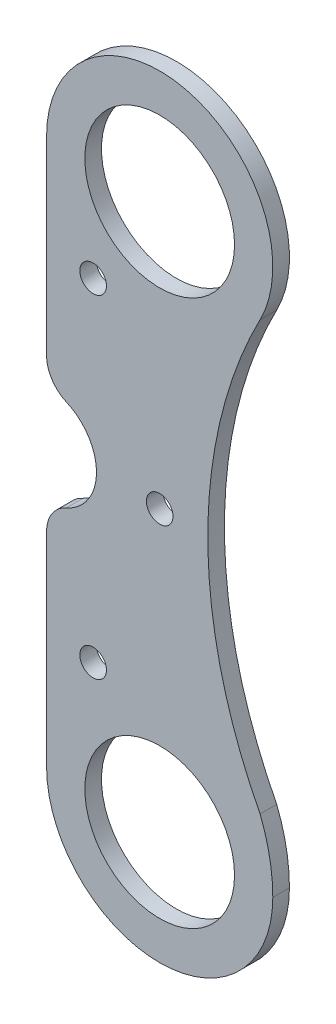
from build123d import *

# Parameters (mm, degrees)
SKETCH1_R           = 14.2875
SKETCH1_R_2         = 2.54
BOSS_EXTRUDE1_DEPTH = 3.175
CUT_EXTRUDE1_DEPTH  = 162.674043733
FILLET3_R           = 6.35
SKETCH3_R           = 2.54
BOSS_EXTRUDE3_DEPTH = 3.175
SKETCH6_R           = 2.54
BOSS_EXTRUDE4_DEPTH = 3.175
FILLET2_R           = 6.35
CUT_EXTRUDE2_DEPTH  = 169.237022961
CUT_EXTRUDE3_DEPTH  = 169.237022961
CUT_EXTRUDE4_DEPTH  = 168.265702461
BOSS_EXTRUDE7_DEPTH = 3.175
SKETCH14_R          = 14.2875
BOSS_EXTRUDE8_DEPTH = 3.175
SKETCH15_R          = 14.2875
CUT_EXTRUDE5_DEPTH  = 128.70732581
CUT_EXTRUDE6_DEPTH  = 128.70732581
SKETCH17_R          = 2.54
CUT_EXTRUDE7_DEPTH  = 128.70732581


with BuildPart() as part:
    # Sketch1 → Boss-Extrude1 (new body)
    with BuildSketch(Plane.XY):
        with BuildLine():
            Line((-8.89, 25.4), (8.89, 25.4))
            ThreePointArc((8.89, 25.4), (17.870256121, 21.680256121), (21.59, 12.7))
            Line((21.59, 12.7), (21.59, -117.775079775))
            ThreePointArc((21.59, -117.775079775), (21.127743647, -120.388718212), (19.797058824, -122.685251408))
            Line((19.797058824, -122.685251408), (-7.952696208, -155.616779465))
            ThreePointArc((-7.952696208, -155.616779465), (-12.268297602, -157.851943494), (-16.900388255, -156.380852124))
            Line((-16.900388255, -156.380852124), (-32.439211784, -143.287061102))
            ThreePointArc((-32.439211784, -143.287061102), (-34.674375812, -138.971459708), (-33.203284443, -134.339369055))
            Line((-33.203284443, -134.339369055), (-23.382941176, -122.685251408))
            ThreePointArc((-23.382941176, -122.685251408), (-22.052256353, -120.388718212), (-21.59, -117.775079775))
            Line((-21.59, -117.775079775), (-21.59, 12.7))
            ThreePointArc((-21.59, 12.7), (-17.870256121, 21.680256121), (-8.89, 25.4))
        make_face()
        Circle(SKETCH1_R, mode=Mode.SUBTRACT)
        with Locations((0, -101.6)):
            Circle(SKETCH1_R, mode=Mode.SUBTRACT)
        with Locations((-18.532085478, -142.550133084)):
            Circle(SKETCH1_R_2, mode=Mode.SUBTRACT)
        with Locations((0, -50.8)):
            Circle(SKETCH1_R_2, mode=Mode.SUBTRACT)
    extrude(amount=BOSS_EXTRUDE1_DEPTH)

    # Sketch2 → Cut-Extrude1 (cut, through all)
    with BuildSketch(Plane.XY):
        with BuildLine():
            ThreePointArc((19.159083004, -91.647229609), (9.182340769, -50.8), (19.159083004, -9.952770391))
            ThreePointArc((19.159083004, -9.952770391), (20.973467787, -5.122670102), (21.59, 0))
            Line((21.59, 0), (27.94, 0))
            Line((27.94, 0), (27.94, -121.656687185))
            Line((27.94, -121.656687185), (-7.620284479, -163.8572221))
            Line((-7.620284479, -163.8572221), (-17.501317584, -155.874478972))
            Line((-17.501317584, -155.874478972), (16.51, -115.512152961))
            ThreePointArc((16.51, -115.512152961), (20.280273667, -109.005308906), (21.59, -101.6))
            ThreePointArc((21.59, -101.6), (20.973467787, -96.477329898), (19.159083004, -91.647229609))
        make_face()
        with BuildLine():
            Line((-21.59, -41.275), (-21.59, -60.325))
            ThreePointArc((-21.59, -60.325), (-12.065, -50.8), (-21.59, -41.275))
        make_face()
    extrude(amount=CUT_EXTRUDE1_DEPTH, mode=Mode.SUBTRACT)


with BuildPart() as cut_extrude1_piece_1:
    # of the separate pieces the step leaves, piece 1, a body of its own (cut_extrude1_pieces)
    add(part.part.solids().sort_by_distance((-8.89, 25.4, 0))[0])

    # Fillet3
    fillet3_edges = [cut_extrude1_piece_1.edges().sort_by_distance(p)[0] for p in [
        (-21.59, -41.275, 1.5875),
        (-21.59, -60.325, 1.5875),
    ]]
    fillet(fillet3_edges, radius=FILLET3_R)

    # Sketch3 → Boss-Extrude3 (add)
    with BuildSketch(Plane.XY.offset(3.175)):
        with BuildLine():
            Line((-27.351416194, -127.394768527), (-36.025496499, -137.688579))
            ThreePointArc((-36.025496499, -137.688579), (-37.217489152, -141.441859142), (-35.4063854, -144.93869507))
            Line((-35.4063854, -144.93869507), (-24.403104784, -154.210610454))
            ThreePointArc((-24.403104784, -154.210610454), (-19.771014132, -155.681701823), (-15.455412737, -153.446537795))
            Line((-15.455412737, -153.446537795), (-7.557639641, -144.073996091))
            Line((-7.557639641, -144.073996091), (-27.351416194, -127.394768527))
        make_face()
        with Locations((-18.532085478, -142.550133084)):
            Circle(SKETCH3_R, mode=Mode.SUBTRACT)
    extrude(amount=-BOSS_EXTRUDE3_DEPTH)

    # Sketch6 → Boss-Extrude4 (add)
    with BuildSketch(Plane.XY.offset(3.175)):
        Polygon((-35.4063854, -144.93869507), (-63.620410749, -121.164144113), (-51.344981666, -106.596497054), (-27.065569901, -127.055545526), align=None)
        with Locations((-52.626813855, -117.972130278)):
            Circle(SKETCH6_R, mode=Mode.SUBTRACT)
    extrude(amount=-BOSS_EXTRUDE4_DEPTH)

    # Fillet2
    fillet2_edges = [cut_extrude1_piece_1.edges().sort_by_distance(p)[0] for p in [
        (-63.620410749, -121.164144113, 1.5875),
        (-51.344981666, -106.596497054, 1.5875),
        (-27.065569901, -127.055545526, 1.5875),
    ]]
    fillet(fillet2_edges, radius=FILLET2_R)

    # Sketch7 → Cut-Extrude2 (cut, through all)
    with BuildSketch(Plane.XY.offset(3.175)):
        with BuildLine():
            Line((-21.59, 0), (-21.59, 31.75))
            Line((-21.59, 31.75), (21.59, 31.75))
            Line((21.59, 31.75), (21.59, 0))
            ThreePointArc((21.59, 0), (0, 21.59), (-21.59, 0))
        make_face()
    extrude(amount=-CUT_EXTRUDE2_DEPTH, mode=Mode.SUBTRACT)


with BuildPart() as cut_extrude1_piece_2:
    # of the separate pieces the step leaves, piece 2, a body of its own (cut_extrude1_pieces)
    add(part.part.solids().sort_by_distance((-16.900388255, -156.380852124, 0))[0])


with BuildPart() as cut_extrude3_tool:
    # Sketch10 → Cut-Extrude3 (new, through all)
    with BuildSketch(Plane.XY.offset(3.175)):
        with BuildLine():
            Line((-18.151882461, -155.32628042), (-17.361482582, -157.512020269))
            Line((-17.361482582, -157.512020269), (-14.375706423, -156.432313955))
            Line((-14.375706423, -156.432313955), (-15.455412737, -153.446537795))
            ThreePointArc((-15.455412737, -153.446537795), (-16.679911193, -154.563907595), (-18.151882461, -155.32628042))
        make_face()
    extrude(amount=-CUT_EXTRUDE3_DEPTH)


with BuildPart() as cut_extrude1_piece_1_1:
    add(cut_extrude1_piece_1.part)

    # Cut-Extrude3: cut by cut_extrude3_tool
    add(cut_extrude3_tool.part, mode=Mode.SUBTRACT)

    # Sketch12 → Cut-Extrude4 (cut, through all)
    with BuildSketch(Plane.XY.offset(3.175)):
        with BuildLine():
            Line((-21.59, -101.6), (-72.39, -101.6))
            Line((-72.39, -101.6), (-72.39, -165.1))
            Line((-72.39, -165.1), (16.51, -165.1))
            Line((16.51, -165.1), (16.51, -115.512152961))
            ThreePointArc((16.51, -115.512152961), (-7.405308906, -121.880273667), (-21.59, -101.6))
        make_face()
    extrude(amount=-CUT_EXTRUDE4_DEPTH, mode=Mode.SUBTRACT)

    # Sketch13 → Boss-Extrude7 (add, through all)
    with BuildSketch(Plane.XY.offset(3.175)):
        with BuildLine():
            Line((-21.59, -101.6), (-21.59, -104.23906))
            ThreePointArc((-21.59, -104.23906), (0, -125.82906), (21.59, -104.23906))
            Line((21.59, -104.23906), (21.59, -101.6))
            Line((21.59, -101.6), (6.662926134, -118.366401535))
            Line((6.662926134, -118.366401535), (-7.350026675, -118.366401535))
            Line((-7.350026675, -118.366401535), (-21.59, -101.6))
        make_face()
    extrude(amount=-BOSS_EXTRUDE7_DEPTH)

    # Sketch14 → Boss-Extrude8 (add, through all)
    with BuildSketch(Plane.XY.offset(3.175)):
        with Locations((0, -101.6)):
            Circle(SKETCH14_R)
    extrude(amount=-BOSS_EXTRUDE8_DEPTH)

    # Sketch15 → Cut-Extrude5 (cut, through all)
    with BuildSketch(Plane.XY.offset(3.175)):
        with Locations((0, -104.23906)):
            Circle(SKETCH15_R)
    extrude(amount=-CUT_EXTRUDE5_DEPTH, mode=Mode.SUBTRACT)

    # Sketch16 → Cut-Extrude6 (cut, through all)
    with BuildSketch(Plane.XY.offset(3.175)):
        with BuildLine():
            Line((19.159083004, -91.647229609), (21.59, -91.647229609))
            Line((21.59, -91.647229609), (21.59, -104.23906))
            ThreePointArc((21.59, -104.23906), (20.97671132, -97.826892854), (19.159083004, -91.647229609))
        make_face()
    extrude(amount=-CUT_EXTRUDE6_DEPTH, mode=Mode.SUBTRACT)

    # Sketch17 → Cut-Extrude7 (cut, through all)
    with BuildSketch(Plane(origin=(0, 0, 0), x_dir=(-1, 0, 0), z_dir=(0, 0, -1))):
        with Locations((12.7, -19.05)):
            Circle(SKETCH17_R)
        with Locations((12.7, -82.55)):
            Circle(SKETCH17_R)
        with Locations(Location((0, -50.8, 0), (0, 0, 180))):
            Circle(SKETCH17_R)
    extrude(amount=-CUT_EXTRUDE7_DEPTH, mode=Mode.SUBTRACT)


with BuildPart() as cut_extrude1_piece_2_1:
    add(cut_extrude1_piece_2.part)

    # Cut-Extrude3: cut by cut_extrude3_tool
    add(cut_extrude3_tool.part, mode=Mode.SUBTRACT)


solid = cut_extrude1_piece_1_1.part
